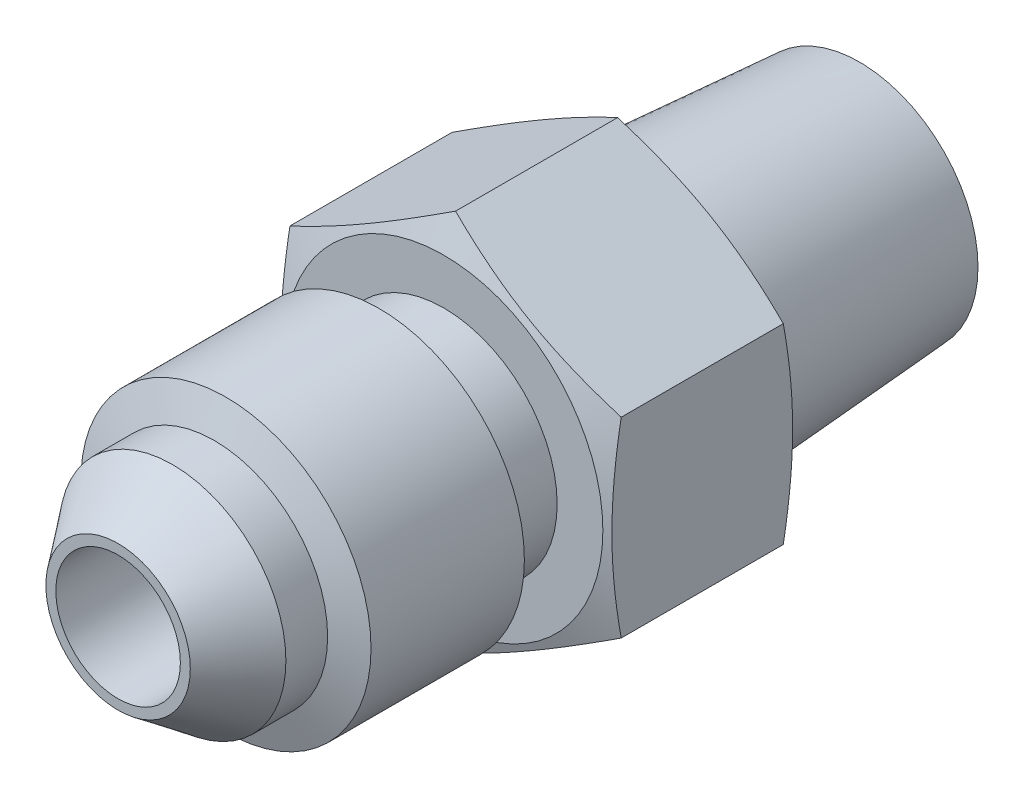
from build123d import *

# Parameters (mm, degrees)
SKETCH2_OUTSIDE_W  = 26.768
SKETCH2_OUTSIDE_H  = 26.768
CUT_EXTRUDE1_DEPTH = 31.938714767


with BuildPart() as part:
    # Sketch1 → Revolve1 (revolve)
    with BuildSketch(Plane(origin=(0, 0, 0), x_dir=(0, 0, -1), z_dir=(1, 0, 0)), mode=Mode.PRIVATE) as revolve1_sk:
        Polygon((-12.809985226, 2.3876), (-28.426098562, 2.3876), (-28.426098562, 2.7686), (-26.336268377, 4.3434), (-24.736068377, 4.3434), (-24.292315867, 5.5626), (-18.413231404, 5.5626), (-17.969478894, 4.3434), (-15.937478894, 4.3434), (-15.937478894, 6.096), (-15.012994499, 8.636), (-9.749963289, 8.636), (-8.825478894, 6.096), (-8.825478894, 5.1562), (0, 4.539062397), (0, 2.5781), (-12.7, 2.5781), align=None)
    revolve(revolve1_sk.sketch.rotate(Axis((0, 0, -2.001994087), (0, 0, -1)), 90), axis=Axis((0, 0, -2.001994087), (0, 0, -1)))

    # Sketch2 outside → Cut-Extrude1 (cut, through all)
    with BuildSketch(Plane.XY):
        Rectangle(SKETCH2_OUTSIDE_W, SKETCH2_OUTSIDE_H)
        Polygon((0, 7.332348419), (-6.35, 3.666174209), (-6.35, -3.666174209), (0, -7.332348419), (6.35, -3.666174209), (6.35, 3.666174209), align=None, mode=Mode.SUBTRACT)
    extrude(amount=CUT_EXTRUDE1_DEPTH, mode=Mode.SUBTRACT)


solid = part.part
